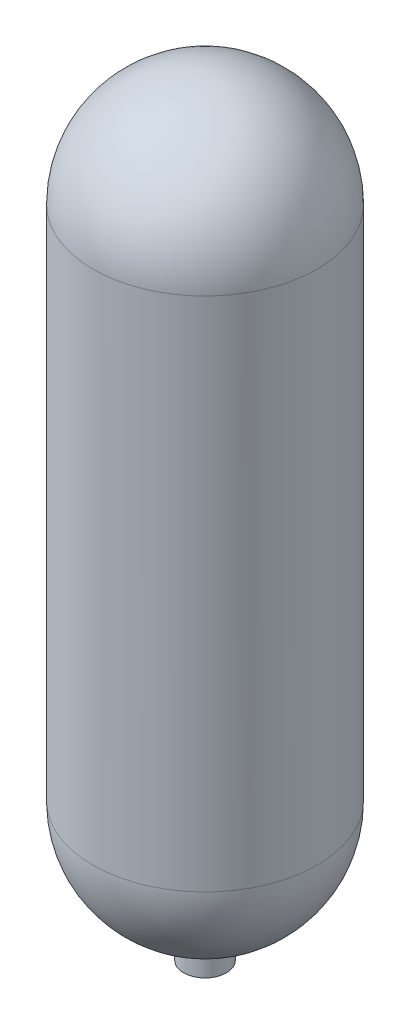
from build123d import *

# Parameters (mm, degrees)
M18X1_5_TAPPED_HOLE1_D     = 16.5
M18X1_5_TAPPED_HOLE1_DEPTH = 15.042899893
M18X1_5_TAPPED_HOLE1_TIP   = 4.957100107
FILLET1_R                  = 5


with BuildPart() as part:
    # Sketch1 → Revolve1 (revolve)
    with BuildSketch(Plane.XY, mode=Mode.PRIVATE) as revolve1_sk:
        with BuildLine():
            Line((0, 0), (15, 0))
            Line((15, 0), (15, 20))
            ThreePointArc((15, 20), (60.57949323, 47.129861035), (78.5, 97.053552806))
            Line((78.5, 97.053552806), (78.5, 458.5))
            ThreePointArc((78.5, 458.5), (55.507882323, 514.007882323), (0, 537))
            Line((0, 537), (0, 0))
        make_face()
    revolve(revolve1_sk.sketch.rotate(Axis((0, 0, 0), (0, 1, 0)), 90), axis=Axis((0, 0, 0), (0, 1, 0)))

    # M18x1.5 Tapped Hole1
    with Locations(Plane(origin=(0, 0, 0), x_dir=(-1, 0, 0), z_dir=(0, -1, 0))):
        with Locations((0, 0)):
            Hole(M18X1_5_TAPPED_HOLE1_D / 2, depth=M18X1_5_TAPPED_HOLE1_DEPTH)
            with Locations((0, 0, -(M18X1_5_TAPPED_HOLE1_DEPTH + M18X1_5_TAPPED_HOLE1_TIP / 2))):  # 118° drill point
                Cone(0, M18X1_5_TAPPED_HOLE1_D / 2, M18X1_5_TAPPED_HOLE1_TIP, mode=Mode.SUBTRACT)

    # Fillet1
    fillet1_edges = [part.edges().sort_by_distance(p)[0] for p in [
        (0, 20, 15),
    ]]
    fillet(fillet1_edges, radius=FILLET1_R)

    # Sketch4 → Cut-Revolve1 (revolve, cut)
    with BuildSketch(Plane.XY):
        with BuildLine():
            Line((8.25, 15.042899893), (8.25, 25.693050045))
            Line((8.25, 25.693050045), (17.604790419, 25.693050045))
            ThreePointArc((17.604790419, 25.693050045), (57.862777741, 51.730832763), (73.5, 97.053552806))
            Line((73.5, 97.053552806), (73.5, 458.5))
            ThreePointArc((73.5, 458.5), (51.972348417, 510.472348417), (0, 532))
            Line((0, 532), (0, 15.042899893))
            Line((0, 15.042899893), (8.25, 15.042899893))
        make_face()
    revolve(axis=Axis((0, 0, 0), (0, 1, 0)), mode=Mode.SUBTRACT)


solid = part.part
